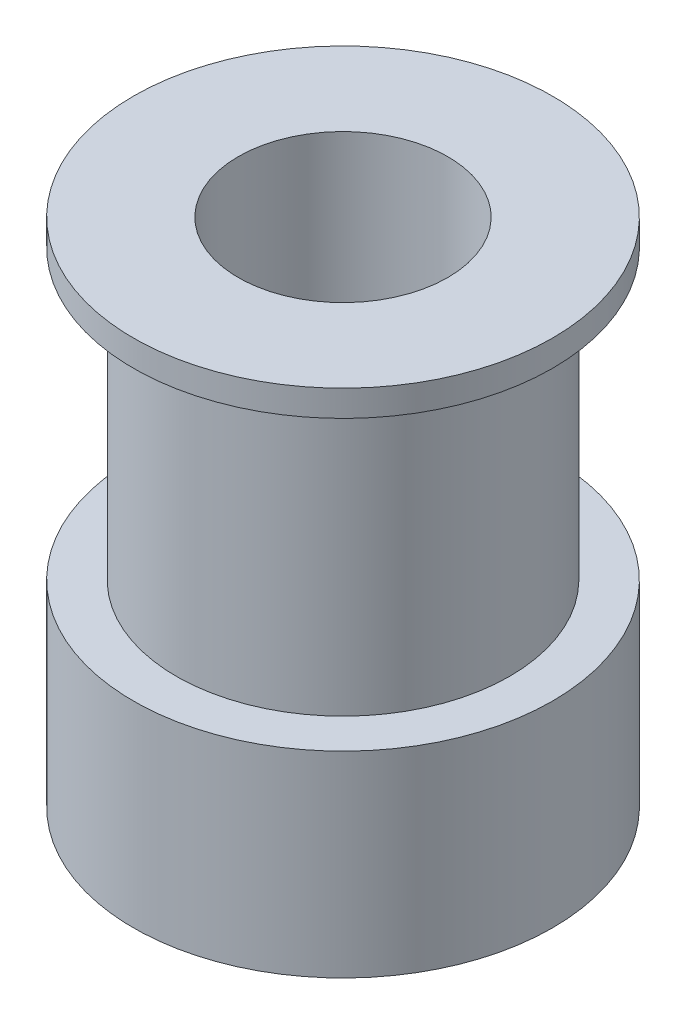
from build123d import *

# Parameters (mm, degrees)
SKETCH_2_R          = 1.5
CUT_EXTRUDE_1_DEPTH = 10


with BuildPart() as part:
    # Эскиз1 → Повернуть1 (revolve)
    with BuildSketch(Plane.XY):
        Polygon((8, 19.5), (4, 19.5), (4, 0), (8, 0), (8, 7.5), (6.365, 7.5), (6.365, 18.5), (8, 18.5), align=None)
    revolve(axis=Axis((0, -1000, 0), (0, 1, 0)))

    # Эскиз2 → Вырез-Вытянуть1 (cut)
    with BuildSketch(Plane.XY):
        with Locations((0, 3.5)):
            Circle(SKETCH_2_R)
    extrude(amount=-CUT_EXTRUDE_1_DEPTH, mode=Mode.SUBTRACT)


solid = part.part
